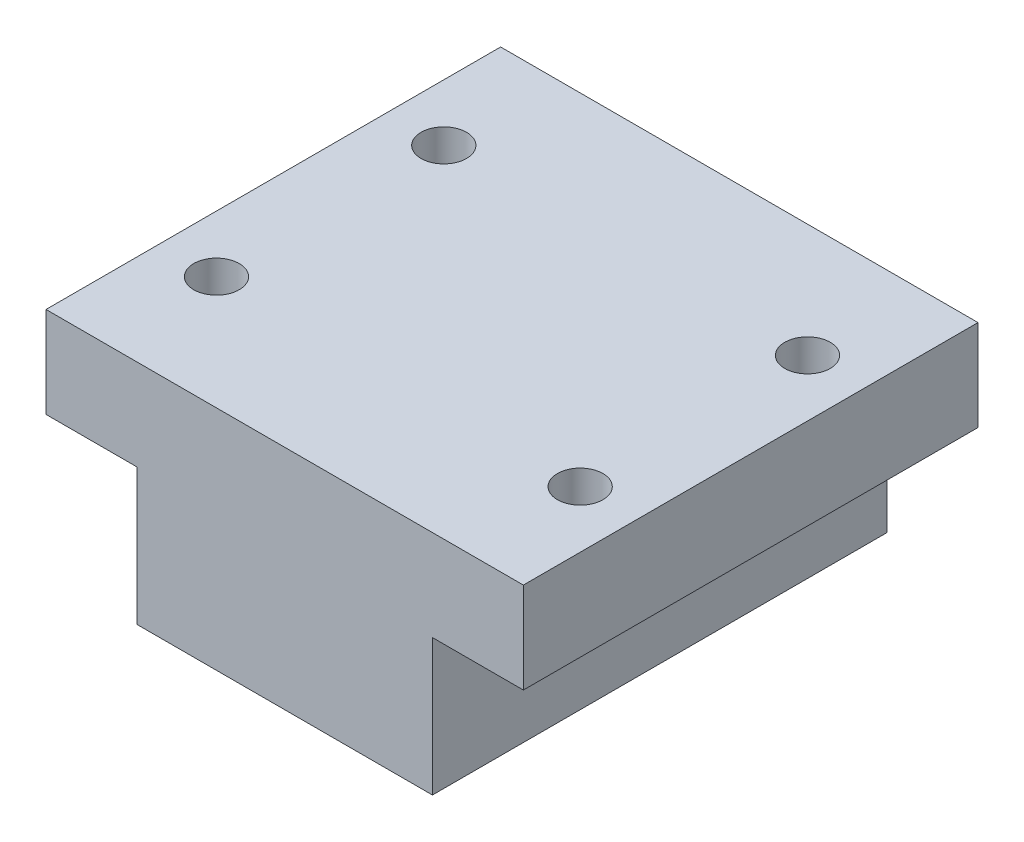
from build123d import *

# Parameters (mm, degrees)
BOSS_EXTRUDE1_DEPTH = 20
SKETCH2_R           = 2
CUT_EXTRUDE1_DEPTH  = 40
SKETCH4_R           = 5.5
CUT_EXTRUDE2_DEPTH  = 1.75


with BuildPart() as part:
    # Sketch1 → Boss-Extrude1 (new, symmetric)
    with BuildSketch(Plane.XY):
        Polygon((13, -4), (21, -4), (21, 4), (-21, 4), (-21, -4), (-13, -4), (-13, -16), (13, -16), align=None)
    extrude(amount=BOSS_EXTRUDE1_DEPTH, both=True)

    # Sketch2 → Cut-Extrude1 (cut)
    with BuildSketch(Plane(origin=(0, 4, 0), x_dir=(1, 0, 0), z_dir=(0, 1, 0))):
        with Locations(Location((-16, 10, 0), (0, 0, 270))):
            Circle(SKETCH2_R)
        with Locations(Location((16, 10, 0), (0, 0, 270))):
            Circle(SKETCH2_R)
        with Locations(Location((-16, -10, 0), (0, 0, 270))):
            Circle(SKETCH2_R)
        with Locations(Location((16, -10, 0), (0, 0, 270))):
            Circle(SKETCH2_R)
    extrude(amount=-CUT_EXTRUDE1_DEPTH, mode=Mode.SUBTRACT)

    # Sketch4 → Cut-Extrude2 (cut)
    with BuildSketch(Plane.XZ.offset(16)):
        with Locations((0, -4.5)):
            Circle(SKETCH4_R)
    extrude(amount=-CUT_EXTRUDE2_DEPTH, mode=Mode.SUBTRACT)


solid = part.part
